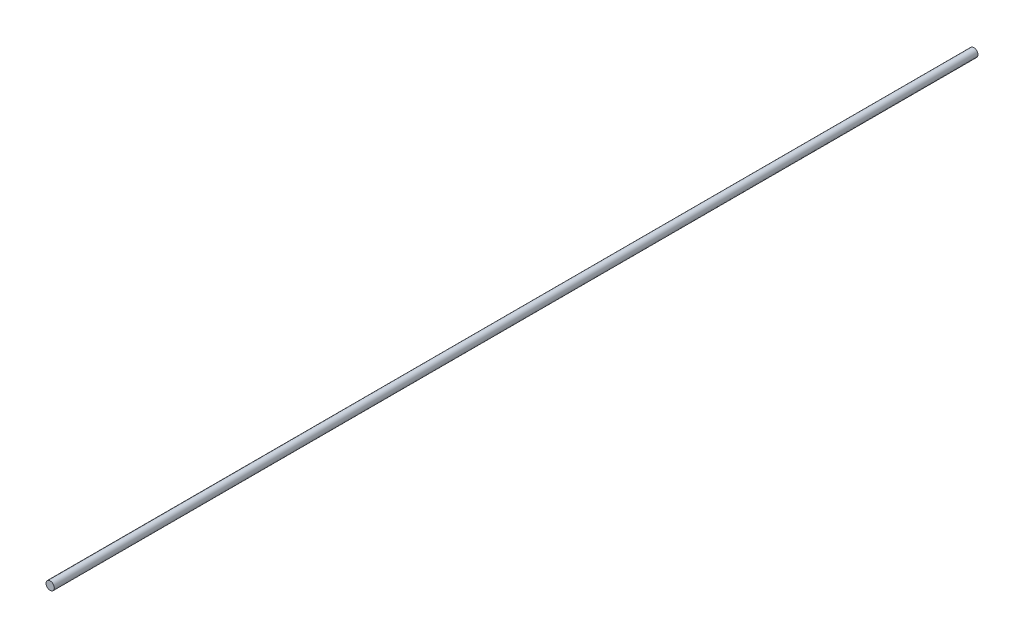
from build123d import *

# Parameters (mm, degrees)
ESQUISSE1_R        = 3.1
BOSS_EXTRU_1_DEPTH = 690


with BuildPart() as part:
    # Esquisse1 → Boss.-Extru.1 (new body)
    with BuildSketch(Plane.XY):
        Circle(ESQUISSE1_R)
    extrude(amount=BOSS_EXTRU_1_DEPTH)


solid = part.part
